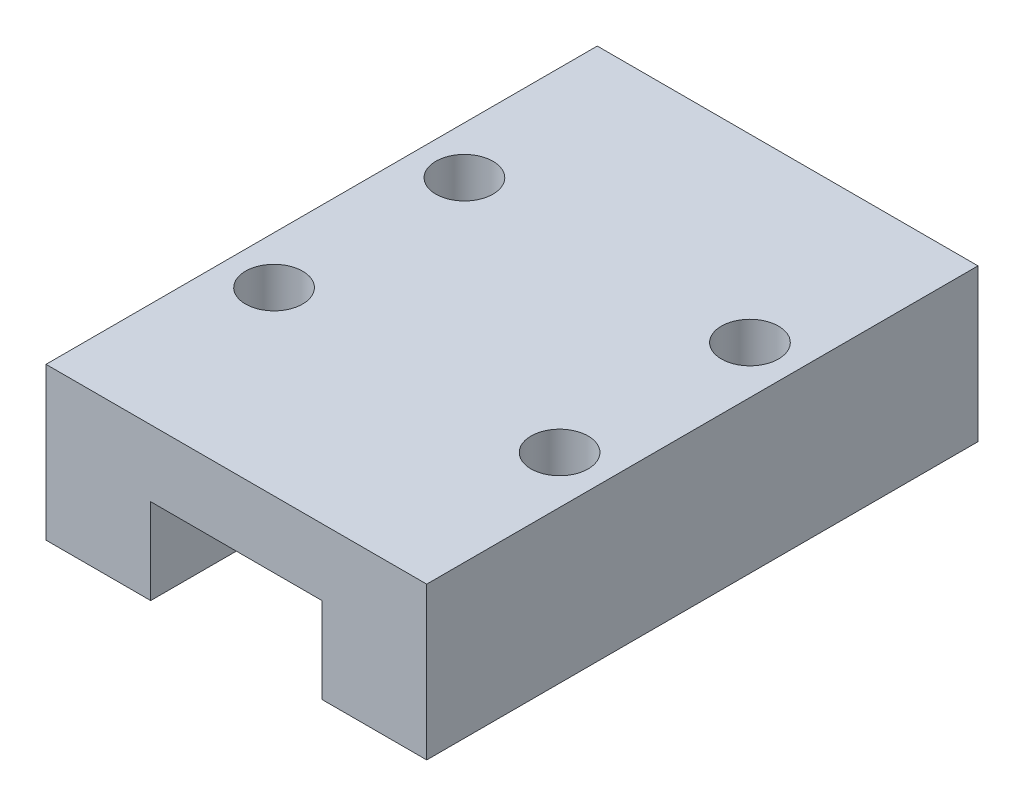
from build123d import *

# Parameters (mm, degrees)
EXTRUDE_1_DEPTH     = 28.96
SKETCH_2_R          = 1.5
CUT_EXTRUDE_1_DEPTH = 28.96


with BuildPart() as part:
    # 草图1 → 凸台-拉伸1 (new body)
    with BuildSketch(Plane.XY):
        Polygon((5.5, 0), (5.5, 4.5), (14.5, 4.5), (14.5, 0), (20, 0), (20, 8), (0, 8), (0, 0), align=None)
    extrude(amount=EXTRUDE_1_DEPTH)

    # 草图2 → 切除-拉伸1 (cut)
    with BuildSketch(Plane(origin=(0, 8, 0), x_dir=(1, 0, 0), z_dir=(0, 1, 0))):
        with Locations(Location((17.5, -9.48, 0), (0, 0, 270))):
            Circle(SKETCH_2_R)
        with Locations(Location((17.5, -19.48, 0), (0, 0, 270))):
            Circle(SKETCH_2_R)
        with Locations(Location((2.5, -19.48, 0), (0, 0, 270))):
            Circle(SKETCH_2_R)
        with Locations(Location((2.5, -9.48, 0), (0, 0, 270))):
            Circle(SKETCH_2_R)
    extrude(amount=-CUT_EXTRUDE_1_DEPTH, mode=Mode.SUBTRACT)


solid = part.part
